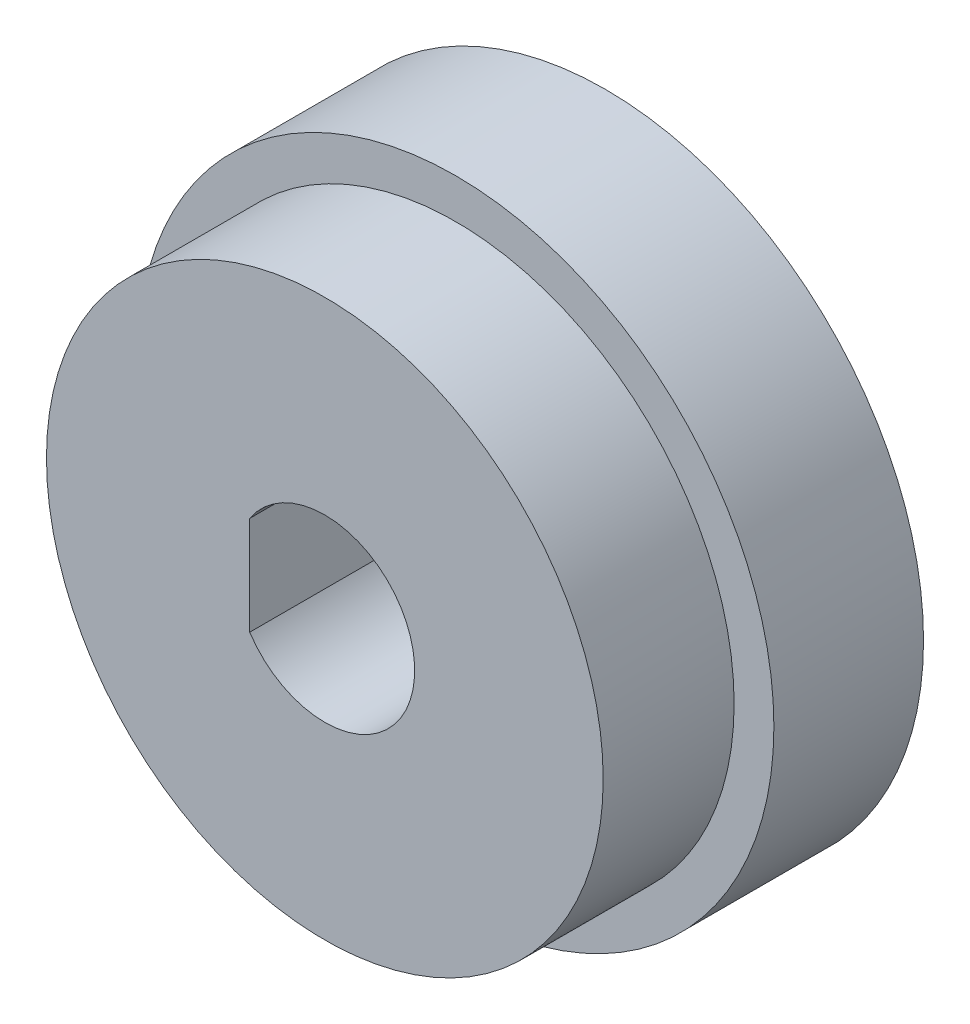
from build123d import *

# Parameters (mm, degrees)
SKETCH1_R           = 10.8
BOSS_EXTRUDE1_DEPTH = 5.08
SKETCH2_R           = 9.45
BOSS_EXTRUDE2_DEPTH = 4.445
CUT_EXTRUDE1_DEPTH  = 19.000156249


with BuildPart() as part:
    # Sketch1 → Boss-Extrude1 (new body)
    with BuildSketch(Plane.XY):
        Circle(SKETCH1_R)
    extrude(amount=BOSS_EXTRUDE1_DEPTH)

    # Sketch2 → Boss-Extrude2 (add)
    with BuildSketch(Plane.XY.offset(5.08)):
        Circle(SKETCH2_R)
    extrude(amount=BOSS_EXTRUDE2_DEPTH)

    # Sketch3 → Cut-Extrude1 (cut, through all)
    with BuildSketch(Plane.XY.offset(9.525)):
        with BuildLine():
            Line((-2.55, 0), (-2.55, 1.673320053))
            ThreePointArc((-2.55, 1.673320053), (3.05, 0), (-2.55, -1.673320053))
            Line((-2.55, -1.673320053), (-2.55, 0))
        make_face()
    extrude(amount=-CUT_EXTRUDE1_DEPTH, mode=Mode.SUBTRACT)


solid = part.part
